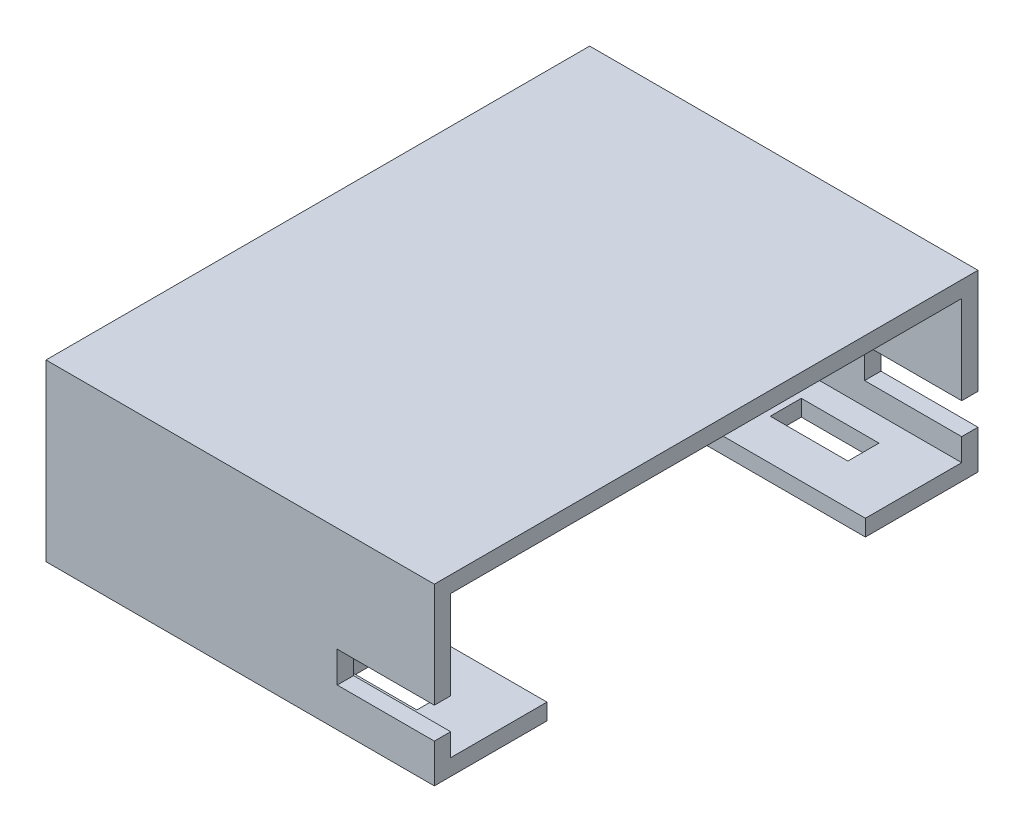
from build123d import *

# Parameters (mm, degrees)
CROQUIS1_W              = 10
CROQUIS1_H              = 14
SALIENTE_EXTRUIR1_DEPTH = 4.5
CROQUIS2_W              = 8.2
CROQUIS2_H              = 4.08
CORTAR_EXTRUIR1_DEPTH   = 5
CORTAR_EXTRUIR2_REACH   = 19.455
CROQUIS3_W              = 5
CROQUIS3_H              = 3.66
CORTAR_EXTRUIR3_REACH   = 19.455
CROQUIS4_W              = 5
CROQUIS4_H              = 3.66
CORTAR_EXTRUIR4_REACH   = 19.783
CROQUIS5_W              = 2.5
CROQUIS5_H              = 0.8
CROQUIS6_W              = 2.5
CROQUIS6_H              = 0.8
CORTAR_EXTRUIR5_DEPTH   = 18.783419244
CORTAR_EXTRUIR6_REACH   = 15.01
CROQUIS7_W              = 2
CROQUIS7_H              = 0.8
CORTAR_EXTRUIR7_REACH   = 15.01
CROQUIS8_W              = 2
CROQUIS8_H              = 0.8


with BuildPart() as part:
    # Croquis1 → Saliente-Extruir1 (new body)
    with BuildSketch(Plane.XZ.offset(4.5)):
        with Locations((5, 0)):
            Rectangle(CROQUIS1_W, CROQUIS1_H)
    extrude(amount=-SALIENTE_EXTRUIR1_DEPTH)

    # Croquis2 → Cortar-Extruir1 (cut)
    with BuildSketch(Plane(origin=(10, 0, 0), x_dir=(0, 0, -1), z_dir=(1, 0, 0))):
        with Locations((0, -2.46)):
            Rectangle(CROQUIS2_W, CROQUIS2_H)
    extrude(amount=-CORTAR_EXTRUIR1_DEPTH, mode=Mode.SUBTRACT)

    # Croquis3 → Cortar-Extruir2 (cut, up to next)
    with BuildSketch(Plane.XY.offset(6.58), mode=Mode.PRIVATE) as cortar_extruir2_sk1:
        with Locations((7.5, -2.25)):
            Rectangle(CROQUIS3_W, CROQUIS3_H)
    cortar_extruir2_tool1 = extrude(cortar_extruir2_sk1.sketch, amount=-CORTAR_EXTRUIR2_REACH, mode=Mode.PRIVATE) & part.part
    add(cortar_extruir2_tool1.solids().sort_by_distance((7.5, -2.25, 6.58))[0], mode=Mode.SUBTRACT)

    # Croquis4 → Cortar-Extruir3 (cut, up to next)
    with BuildSketch(Plane(origin=(0, 0, -6.58), x_dir=(-1, 0, 0), z_dir=(0, 0, -1)), mode=Mode.PRIVATE) as cortar_extruir3_sk1:
        with Locations((-7.5, -2.25)):
            Rectangle(CROQUIS4_W, CROQUIS4_H)
    cortar_extruir3_tool1 = extrude(cortar_extruir3_sk1.sketch, amount=-CORTAR_EXTRUIR3_REACH, mode=Mode.PRIVATE) & part.part
    add(cortar_extruir3_tool1.solids().sort_by_distance((7.5, -2.25, -6.58))[0], mode=Mode.SUBTRACT)

    # Croquis5 → Cortar-Extruir4 (cut, up to next)
    with BuildSketch(Plane(origin=(0, 0, -7), x_dir=(-1, 0, 0), z_dir=(0, 0, -1)), mode=Mode.PRIVATE) as cortar_extruir4_sk1:
        with Locations((-8.75, -3.1)):
            Rectangle(CROQUIS5_W, CROQUIS5_H)
    cortar_extruir4_tool1 = extrude(cortar_extruir4_sk1.sketch, amount=-CORTAR_EXTRUIR4_REACH, mode=Mode.PRIVATE) & part.part
    add(cortar_extruir4_tool1.solids().sort_by_distance((8.75, -3.1, -7))[0], mode=Mode.SUBTRACT)

    # Croquis6 → Cortar-Extruir5 (cut, through all)
    with BuildSketch(Plane.XY.offset(7)):
        with Locations((8.75, -3.1)):
            Rectangle(CROQUIS6_W, CROQUIS6_H)
    extrude(amount=-CORTAR_EXTRUIR5_DEPTH, mode=Mode.SUBTRACT)

    # Croquis7 → Cortar-Extruir6 (cut, up to next)
    with BuildSketch(Plane.XZ.offset(4.5), mode=Mode.PRIVATE) as cortar_extruir6_sk1:
        with Locations((7.5, 5.55)):
            Rectangle(CROQUIS7_W, CROQUIS7_H)
    cortar_extruir6_tool1 = extrude(cortar_extruir6_sk1.sketch, amount=-CORTAR_EXTRUIR6_REACH, mode=Mode.PRIVATE) & part.part
    add(cortar_extruir6_tool1.solids().sort_by_distance((7.5, -4.5, 5.55))[0], mode=Mode.SUBTRACT)

    # Croquis8 → Cortar-Extruir7 (cut, up to next)
    with BuildSketch(Plane.XZ.offset(4.5), mode=Mode.PRIVATE) as cortar_extruir7_sk1:
        with Locations((7.5, -5.55)):
            Rectangle(CROQUIS8_W, CROQUIS8_H)
    cortar_extruir7_tool1 = extrude(cortar_extruir7_sk1.sketch, amount=-CORTAR_EXTRUIR7_REACH, mode=Mode.PRIVATE) & part.part
    add(cortar_extruir7_tool1.solids().sort_by_distance((7.5, -4.5, -5.55))[0], mode=Mode.SUBTRACT)


solid = part.part
